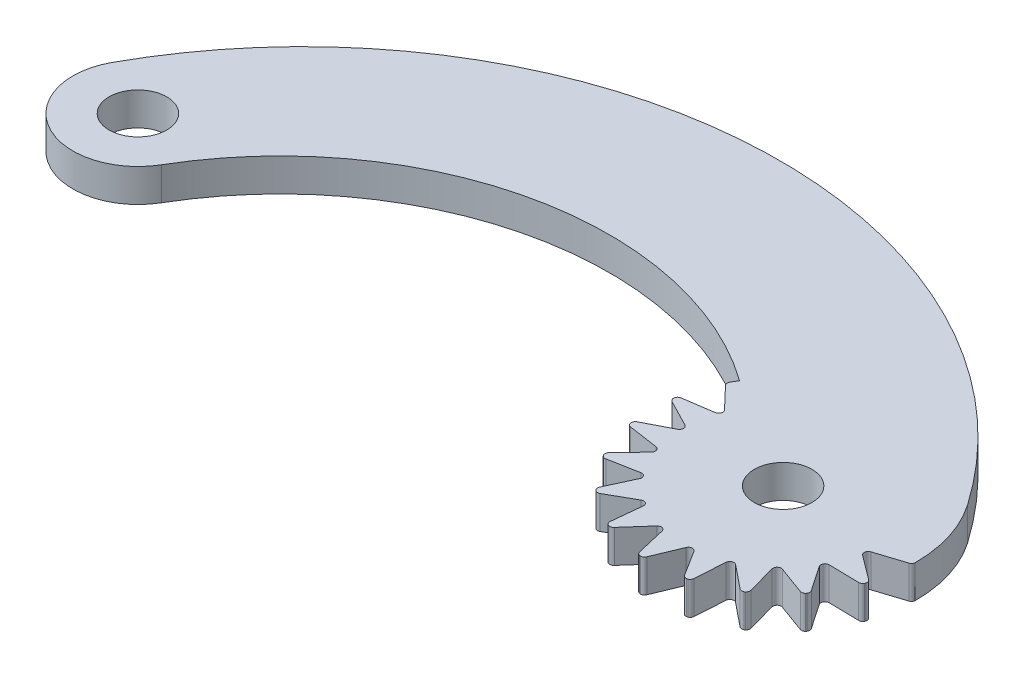
from build123d import *

# Parameters (mm, degrees)
SKETCH1_R           = 1.75
BOSS_EXTRUDE1_DEPTH = 1
CUT_EXTRUDE1_DEPTH  = 10


with BuildPart() as part:
    # Sketch1 → Boss-Extrude1 (new, symmetric)
    with BuildSketch(Plane(origin=(0, 0, 0), x_dir=(1, 0, 0), z_dir=(0, 1, 0))):
        with BuildLine():
            ThreePointArc((-3.468031679, 1.890834809), (-1.940098765, -3.440714574), (3.412697713, -1.988968154))
            ThreePointArc((3.412697713, -1.988968154), (16.498779461, 7.495751106), (32.323208611, 4.210499669))
            ThreePointArc((32.323208611, 4.210499669), (39.413417069, -8.041566659), (45.776010747, 4.603653267))
            ThreePointArc((45.776010747, 4.603653267), (20.398296529, 16.964851371), (-3.468031679, 1.890834809))
        make_face()
        with Locations(Location((0, 0, 0), (0, 0, 270))):
            Circle(SKETCH1_R, mode=Mode.SUBTRACT)
        with Locations(Location((39.178405, 0, 0), (0, 0, 270))):
            Circle(SKETCH1_R, mode=Mode.SUBTRACT)
    extrude(amount=BOSS_EXTRUDE1_DEPTH, both=True)

    # Sketch3 → Cut-Extrude1 (cut)
    with BuildSketch(Plane(origin=(0, 1, 0), x_dir=(1, 0, 0), z_dir=(0, 1, 0))):
        with BuildLine():
            ThreePointArc((32.084811852, 3.795123352), (31.56930529, 2.612207227), (31.24955028, 1.36208951))
            ThreePointArc((31.24955028, 1.36208951), (31.326059207, 1.474902663), (31.450375944, 1.53081127))
            Line((31.450375944, 1.53081127), (33.258253826, 1.797598333))
            ThreePointArc((33.258253826, 1.797598333), (33.381527847, 1.852635734), (33.458211092, 1.963745049))
            ThreePointArc((33.458211092, 1.963745049), (33.46594199, 2.098525734), (33.402466138, 2.217674448))
            Line((33.402466138, 2.217674448), (32.139660471, 3.538628505))
            ThreePointArc((32.139660471, 3.538628505), (32.075896875, 3.659105169), (32.084811852, 3.795123352))
        make_face()
        with BuildLine():
            ThreePointArc((31.236887758, 1.286207175), (31.133405, 0), (31.236887758, -1.286207175))
            ThreePointArc((31.236887758, -1.286207175), (31.272620849, -1.154664142), (31.372048268, -1.061419239))
            Line((31.372048268, -1.061419239), (32.995344721, -0.222070447))
            ThreePointArc((32.995344721, -0.222070447), (33.094068801, -0.129988115), (33.130520001, 0))
            ThreePointArc((33.130520001, 0), (33.094068801, 0.129988115), (32.995344721, 0.222070447))
            Line((32.995344721, 0.222070447), (31.372048268, 1.061419239))
            ThreePointArc((31.372048268, 1.061419239), (31.272620849, 1.154664142), (31.236887758, 1.286207175))
        make_face()
        with BuildLine():
            ThreePointArc((31.24955028, -1.36208951), (31.569305291, -2.61220723), (32.084811854, -3.795123356))
            ThreePointArc((32.084811854, -3.795123356), (32.075896875, -3.659105171), (32.139660471, -3.538628505))
            Line((32.139660471, -3.538628505), (33.402466138, -2.217674449))
            ThreePointArc((33.402466138, -2.217674449), (33.46594199, -2.098525734), (33.458211092, -1.963745049))
            ThreePointArc((33.458211092, -1.963745049), (33.381527847, -1.852635735), (33.258253826, -1.797598333))
            Line((33.258253826, -1.797598333), (31.450375944, -1.53081127))
            ThreePointArc((31.450375944, -1.53081127), (31.326059207, -1.474902664), (31.24955028, -1.36208951))
        make_face()
        with BuildLine():
            ThreePointArc((32.12142724, -3.862782663), (32.829769602, -4.941341274), (33.701436836, -5.892779033))
            ThreePointArc((33.701436836, -5.892779033), (33.648839863, -5.767025378), (33.670029862, -5.632372464))
            Line((33.670029862, -5.632372464), (34.435500154, -3.972959013))
            ThreePointArc((34.435500154, -3.972959013), (34.456849185, -3.839655529), (34.405773951, -3.714687852))
            ThreePointArc((34.405773951, -3.714687852), (34.29716848, -3.634497755), (34.16270317, -3.622469441))
            Line((34.16270317, -3.622469441), (32.366155482, -3.957154626))
            ThreePointArc((32.366155482, -3.957154626), (32.230421073, -3.94464088), (32.12142724, -3.862782663))
        make_face()
        with BuildLine():
            ThreePointArc((33.758037242, -5.944883377), (34.778207068, -6.735004318), (35.911576302, -7.351860666))
            ThreePointArc((35.911576302, -7.351860666), (35.820997033, -7.249998901), (35.79731717, -7.115761472))
            Line((35.79731717, -7.115761472), (35.982501503, -5.297711821))
            ThreePointArc((35.982501503, -5.297711821), (35.959410215, -5.164699069), (35.870525439, -5.063086586))
            ThreePointArc((35.870525439, -5.063086586), (35.741766831, -5.022505549), (35.610681635, -5.054789777))
            Line((35.610681635, -5.054789777), (34.020147957, -5.954678876))
            ThreePointArc((34.020147957, -5.954678876), (33.887704808, -5.98691605), (33.758037242, -5.944883377))
        make_face()
        with BuildLine():
            ThreePointArc((35.982028195, -7.382763732), (37.203474256, -7.798825139), (38.475727347, -8.014254121))
            ThreePointArc((38.475727347, -8.014254121), (38.356981452, -7.947322547), (38.290997808, -7.828047312))
            Line((38.290997808, -7.828047312), (37.875828586, -6.048375351))
            ThreePointArc((37.875828586, -6.048375351), (37.810799277, -5.930067325), (37.693737005, -5.862821327))
            ThreePointArc((37.693737005, -5.862821327), (37.558778252, -5.866246934), (37.445278285, -5.939345207))
            Line((37.445278285, -5.939345207), (36.233117622, -7.306921274))
            ThreePointArc((36.233117622, -7.306921274), (36.118318001, -7.380415969), (35.982028195, -7.382763732))
        make_face()
        with BuildLine():
            ThreePointArc((38.552396173, -8.020607081), (39.842755834, -8.017522246), (41.116024419, -7.808178788))
            ThreePointArc((41.116024419, -7.808178788), (40.981979858, -7.78343048), (40.880842784, -7.692042761))
            Line((40.880842784, -7.692042761), (39.910310035, -6.143603561))
            ThreePointArc((39.910310035, -6.143603561), (39.810389641, -6.052820773), (39.677835385, -6.027228406))
            ThreePointArc((39.677835385, -6.027228406), (39.551301362, -6.07428944), (39.467686107, -6.180280426))
            Line((39.467686107, -6.180280426), (38.765254875, -7.867345373))
            ThreePointArc((38.765254875, -7.867345373), (38.680539103, -7.974133298), (38.552396173, -8.020607081))
        make_face()
        with BuildLine():
            ThreePointArc((41.19060192, -7.7892932), (42.410044691, -7.367396413), (43.546350362, -6.755966128))
            ThreePointArc((43.546350362, -6.755966128), (43.411532943, -6.776082949), (43.286202211, -6.722486022))
            Line((43.286202211, -6.722486022), (41.865478217, -5.573076998))
            ThreePointArc((41.865478217, -5.573076998), (41.741494662, -5.519657171), (41.607812733, -5.538491765))
            ThreePointArc((41.607812733, -5.538491765), (41.503415366, -5.624088433), (41.458745833, -5.751486363))
            Line((41.458745833, -5.751486363), (41.342163355, -7.575220526))
            ThreePointArc((41.342163355, -7.575220526), (41.296711701, -7.703729554), (41.19060192, -7.7892932))
        make_face()
        with BuildLine():
            ThreePointArc((43.610754909, -6.713888537), (44.627135244, -5.918898861), (45.503341649, -4.971639708))
            ThreePointArc((45.503341649, -4.971639708), (45.382360931, -5.034441688), (45.246418071, -5.024443613))
            Line((45.246418071, -5.024443613), (43.529460322, -4.398621067))
            ThreePointArc((43.529460322, -4.398621067), (43.394849148, -4.388353068), (43.274526058, -4.449573603))
            ThreePointArc((43.274526058, -4.449573603), (43.20357842, -4.564430177), (43.202695246, -4.69942951))
            Line((43.202695246, -4.69942951), (43.684595043, -6.462202994))
            ThreePointArc((43.684595043, -6.462202994), (43.683332898, -6.598507176), (43.610754909, -6.713888537))
        make_face()
        with BuildLine():
            ThreePointArc((45.55059401, -4.910929874), (46.253771328, -3.828996777), (46.77492791, -2.648558983))
            ThreePointArc((46.77492791, -2.648558983), (46.68089403, -2.747240553), (46.549070559, -2.781924776))
            Line((46.549070559, -2.781924776), (44.721938068, -2.747506292))
            ThreePointArc((44.721938068, -2.747506292), (44.591286486, -2.781502818), (44.497361108, -2.878475099))
            ThreePointArc((44.497361108, -2.878475099), (44.467551477, -3.010145087), (44.510550368, -3.13811655))
            Line((44.510550368, -3.13811655), (45.538711119, -4.648905496))
            ThreePointArc((45.538711119, -4.648905496), (45.581775256, -4.778234159), (45.55059401, -4.910929874))
        make_face()
        with BuildLine():
            Line((47.052997067, -0.237941224), (45.313687991, -0.798656578))
            ThreePointArc((45.313687991, -0.798656578), (45.201154125, -0.873233578), (45.143804731, -0.995449154))
            ThreePointArc((45.143804731, -0.995449154), (45.158363444, -1.12966407), (45.240584802, -1.236739969))
            Line((45.240584802, -1.236739969), (46.703589337, -2.331826952))
            ThreePointArc((46.703589337, -2.331826952), (46.786313088, -2.440165329), (46.799907556, -2.575795758))
            ThreePointArc((46.799907556, -2.575795758), (47.113681686, -1.324163479), (47.223313041, -0.038465795))
            ThreePointArc((47.223313041, -0.038465795), (47.16641603, -0.162333277), (47.052997067, -0.237941224))
        make_face()
    extrude(amount=-CUT_EXTRUDE1_DEPTH, mode=Mode.SUBTRACT)


solid = part.part
